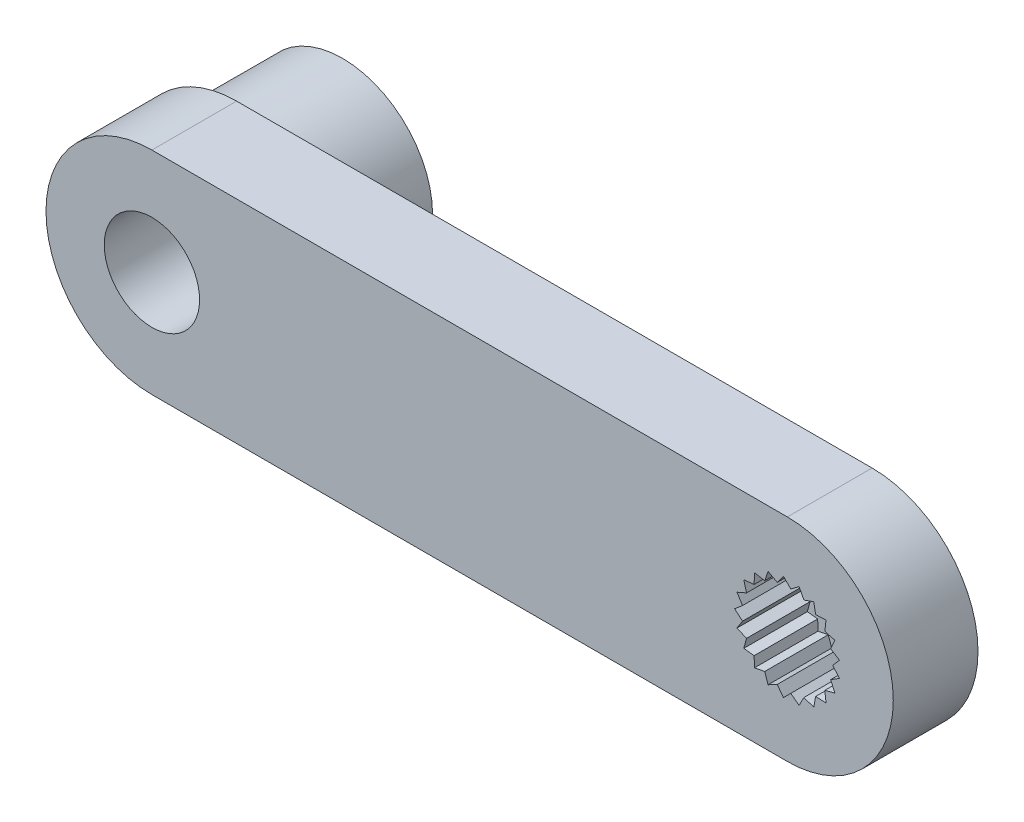
from build123d import *
from build123d.topology import SkipClean

# Parameters (mm, degrees)
SKETCH1_R           = 2.25
SKETCH1_R_2         = 1
BOSS_EXTRUDE1_DEPTH = 2
SKETCH2_R           = 2.49
CUT_EXTRUDE1_DEPTH  = 3
BOSS_EXTRUDE2_START = 1
SKETCH3_R           = 3
SKETCH3_R_2         = 1
BOSS_EXTRUDE2_DEPTH = 1
BOSS_EXTRUDE3_START = 5
SKETCH4_R           = 4.25
SKETCH4_R_2         = 2.25
BOSS_EXTRUDE3_DEPTH = 5
BOSS_EXTRUDE4_DEPTH = 3.2
CIRPATTERN2_COUNT   = 21


with BuildPart() as part:
    # Sketch1 → Boss-Extrude1 (new, symmetric)
    with BuildSketch(Plane.XY):
        with BuildLine():
            Line((0, 5), (30, 5))
            ThreePointArc((30, 5), (35, 0), (30, -5))
            Line((30, -5), (0, -5))
            ThreePointArc((0, -5), (-5, 0), (0, 5))
        make_face()
        Circle(SKETCH1_R, mode=Mode.SUBTRACT)
        with Locations((30, 0)):
            Circle(SKETCH1_R_2, mode=Mode.SUBTRACT)
    extrude(amount=BOSS_EXTRUDE1_DEPTH, both=True)

    # Sketch2 → Cut-Extrude1 (cut)
    with BuildSketch(Plane.XY.offset(2)):
        with Locations((30, 0)):
            Circle(SKETCH2_R)
    extrude(amount=-CUT_EXTRUDE1_DEPTH, mode=Mode.SUBTRACT)

    # Sketch3 → Boss-Extrude2 (add)
    with BuildSketch(Plane(origin=(0, 0, -2), x_dir=(-1, 0, 0), z_dir=(0, 0, -1)).offset(BOSS_EXTRUDE2_START)):
        with Locations(Location((-30, 0, 0), (0, 0, 180))):
            Circle(SKETCH3_R)
        with Locations((-30, 0)):
            Circle(SKETCH3_R_2, mode=Mode.SUBTRACT)
    extrude(amount=-BOSS_EXTRUDE2_DEPTH)

    # Sketch4 → Boss-Extrude3 (add)
    with SkipClean():  # the faces are left unmerged after this step: merging them gives an invalid solid
        with BuildSketch(Plane(origin=(0, 0, -2), x_dir=(-1, 0, 0), z_dir=(0, 0, -1)).offset(BOSS_EXTRUDE3_START)):
            with Locations(Location((0, 0, 0), (0, 0, 180))):
                Circle(SKETCH4_R)
            Circle(SKETCH4_R_2, mode=Mode.SUBTRACT)
        extrude(amount=-BOSS_EXTRUDE3_DEPTH)

    # Sketch5 → Boss-Extrude4 (add)
    with SkipClean():  # the faces are left unmerged after this step: merging them gives an invalid solid
        with BuildSketch(Plane.XY.offset(2)):
            with BuildLine():
                Line((32.462188757, 0.371115243), (32.14, 0))
                Line((32.14, 0), (32.462188757, -0.371115243))
                ThreePointArc((32.462188757, -0.371115243), (32.49, 0), (32.462188757, 0.371115243))
            make_face()
        boss_extrude4 = extrude(amount=-BOSS_EXTRUDE4_DEPTH)

    # CirPattern2: Boss-Extrude4 ×21 about axis
    with SkipClean():  # the faces are left unmerged after this step: merging them gives an invalid solid
        cirpattern2_axis = Axis((30, 0, 0), (0, 0, 1))
        for i in range(1, CIRPATTERN2_COUNT):
            add(boss_extrude4.rotate(cirpattern2_axis, i * 360 / CIRPATTERN2_COUNT))


solid = part.part
